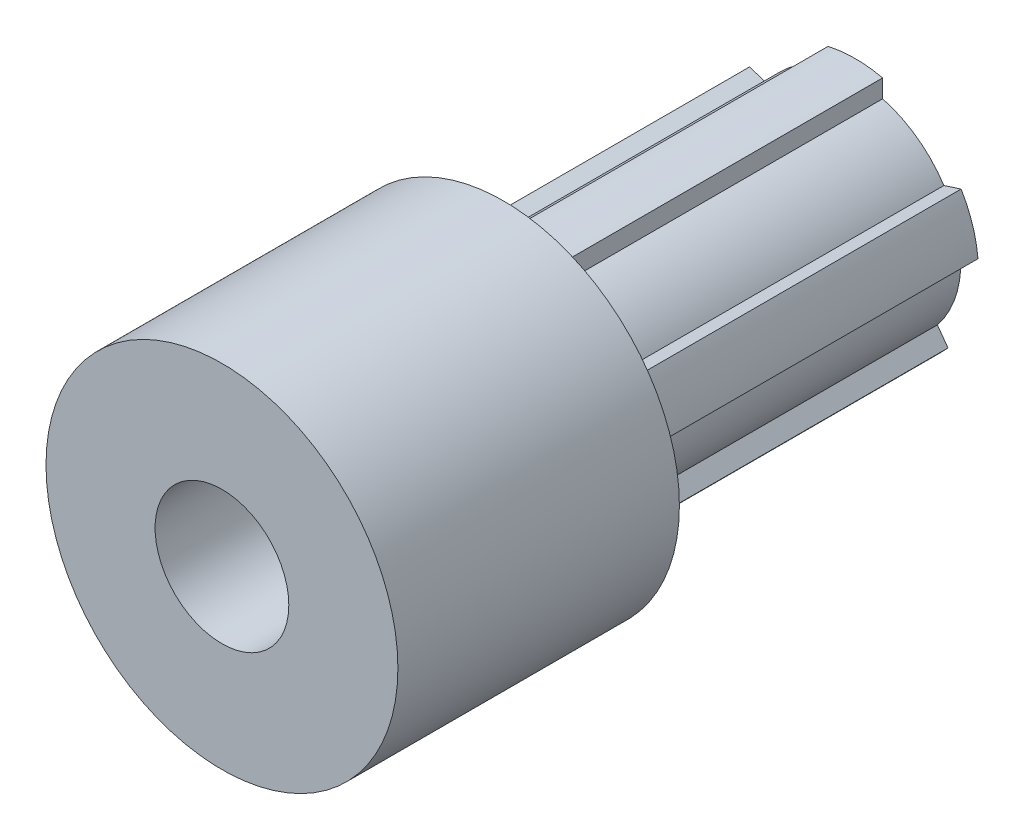
from build123d import *

# Parameters (mm, degrees)
SKETCH1_R           = 25
BOSS_EXTRUDE1_DEPTH = 90
SKETCH2_R           = 25
CUT_EXTRUDE2_DEPTH  = 50
CUT_EXTRUDE4_DEPTH  = 50
SKETCH3_R           = 9.5
CUT_EXTRUDE5_DEPTH  = 29.2
CUT_EXTRUDE6_DEPTH  = 4


with BuildPart() as part:
    # Sketch1 → Boss-Extrude1 (new body)
    with BuildSketch(Plane.XY):
        Circle(SKETCH1_R)
    extrude(amount=BOSS_EXTRUDE1_DEPTH)

    # Sketch2 → Cut-Extrude2 (cut)
    with BuildSketch(Plane(origin=(0, 0, 0), x_dir=(-1, 0, 0), z_dir=(0, 0, -1))):
        Circle(SKETCH2_R)
        with BuildLine():
            ThreePointArc((3.88, 17.064454284), (10.286241915, 14.157797402), (15.030274505, 8.963305657))
            ThreePointArc((15.030274505, 8.963305657), (16.643489035, 5.407797402), (17.428246382, 1.58310709))
            ThreePointArc((17.428246382, 1.58310709), (17.482052392, 0.792366178), (17.5, 0))
            ThreePointArc((17.5, 0), (16.381565231, -6.155836303), (13.169220505, -11.524826736))
            ThreePointArc((13.169220505, -11.524826736), (10.286241915, -14.157797402), (6.891248628, -16.086040294))
            ThreePointArc((6.891248628, -16.086040294), (0, -17.5), (-6.891248628, -16.086040294))
            ThreePointArc((-6.891248628, -16.086040294), (-10.286241915, -14.157797402), (-13.169220505, -11.524826736))
            ThreePointArc((-13.169220505, -11.524826736), (-16.643489035, -5.407797402), (-17.428246382, 1.58310709))
            ThreePointArc((-17.428246382, 1.58310709), (-16.643489035, 5.407797402), (-15.030274505, 8.963305657))
            ThreePointArc((-15.030274505, 8.963305657), (-10.286241915, 14.157797402), (-3.88, 17.064454284))
            ThreePointArc((-3.88, 17.064454284), (0, 17.5), (3.88, 17.064454284))
        make_face(mode=Mode.SUBTRACT)
    extrude(amount=-CUT_EXTRUDE2_DEPTH, mode=Mode.SUBTRACT)

    # Sketch2<3> → Cut-Extrude4 (cut)
    with BuildSketch(Plane(origin=(0, 0, 0), x_dir=(-1, 0, 0), z_dir=(0, 0, -1))):
        with BuildLine():
            ThreePointArc((3.88, 14.489499646), (8.816778784, 12.135254916), (12.581347118, 8.167600914))
            Line((12.581347118, 8.167600914), (15.030274505, 8.963305657))
            ThreePointArc((15.030274505, 8.963305657), (10.286241915, 14.157797402), (3.88, 17.064454284))
            Line((3.88, 17.064454284), (3.88, 14.489499646))
        make_face()
        with BuildLine():
            Line((17.428246382, 1.58310709), (14.979318995, 0.787402347))
            ThreePointArc((14.979318995, 0.787402347), (14.265847744, -4.635254916), (11.655700143, -9.441644675))
            Line((11.655700143, -9.441644675), (13.169220505, -11.524826736))
            ThreePointArc((13.169220505, -11.524826736), (16.643489035, -5.407797402), (17.428246382, 1.58310709))
        make_face()
        with BuildLine():
            Line((-3.88, 14.489499646), (-3.88, 17.064454284))
            ThreePointArc((-3.88, 17.064454284), (-10.286241915, 14.157797402), (-15.030274505, 8.963305657))
            Line((-15.030274505, 8.963305657), (-12.581347118, 8.167600914))
            ThreePointArc((-12.581347118, 8.167600914), (-8.816778784, 12.135254916), (-3.88, 14.489499646))
        make_face()
        with BuildLine():
            Line((6.891248628, -16.086040294), (5.377728267, -14.002858233))
            ThreePointArc((5.377728267, -14.002858233), (0, -15), (-5.377728267, -14.002858233))
            Line((-5.377728267, -14.002858233), (-6.891248628, -16.086040294))
            ThreePointArc((-6.891248628, -16.086040294), (0, -17.5), (6.891248628, -16.086040294))
        make_face()
        with BuildLine():
            Line((-14.979318995, 0.787402347), (-17.428246382, 1.58310709))
            ThreePointArc((-17.428246382, 1.58310709), (-16.643489035, -5.407797402), (-13.169220505, -11.524826736))
            Line((-13.169220505, -11.524826736), (-11.655700143, -9.441644675))
            ThreePointArc((-11.655700143, -9.441644675), (-14.265847744, -4.635254916), (-14.979318995, 0.787402347))
        make_face()
    extrude(amount=-CUT_EXTRUDE4_DEPTH, mode=Mode.SUBTRACT)

    # Sketch3 → Cut-Extrude5 (cut)
    with BuildSketch(Plane.XY.offset(90)):
        Circle(SKETCH3_R)
    extrude(amount=-CUT_EXTRUDE5_DEPTH, mode=Mode.SUBTRACT)

    # Sketch5 → Cut-Extrude6 (cut)
    with BuildSketch(Plane(origin=(0, 6.68, 0), x_dir=(1, 0, 0), z_dir=(0, 1, 0))):
        with BuildLine():
            Line((-3, -82.2), (-3, -57.2))
            ThreePointArc((-3, -57.2), (0, -54.2), (3, -57.2))
            Line((3, -57.2), (3, -82.2))
            ThreePointArc((3, -82.2), (0, -85.2), (-3, -82.2))
        make_face()
    extrude(amount=CUT_EXTRUDE6_DEPTH, mode=Mode.SUBTRACT)


solid = part.part
